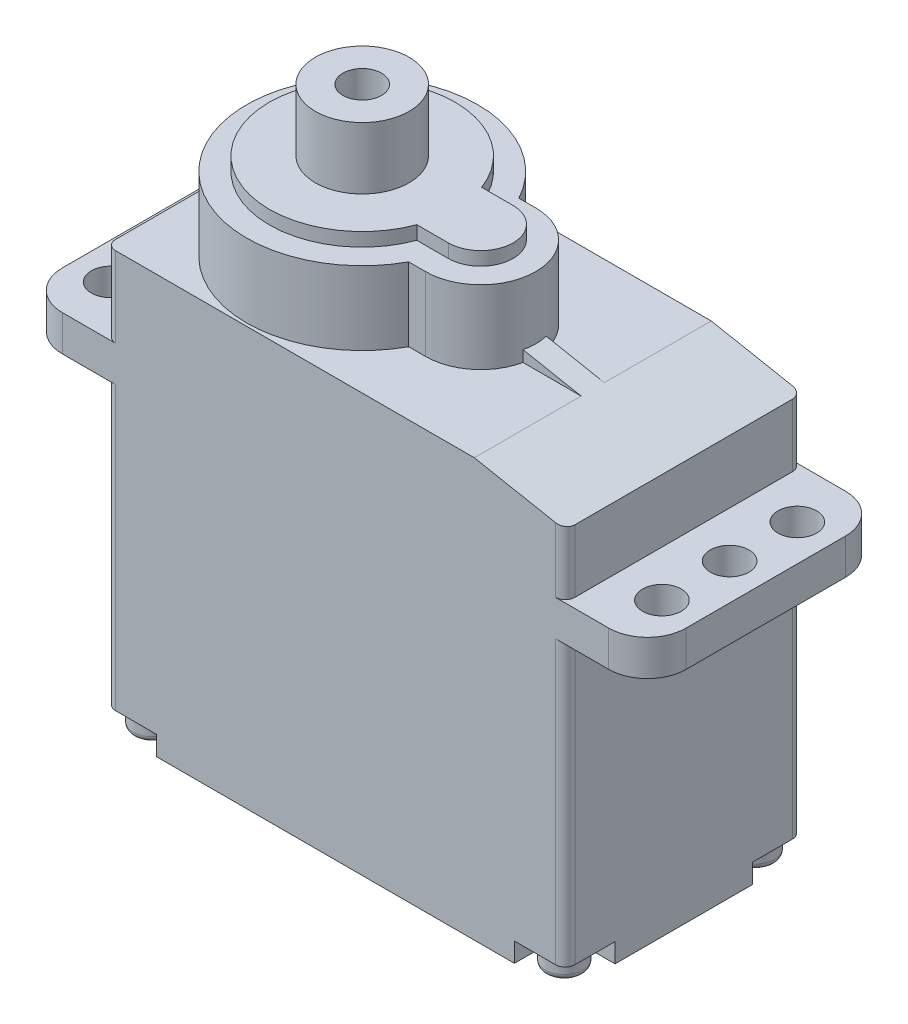
from build123d import *

# Parameters (mm, degrees)
BOSS_EXTRUDE1_DEPTH = 6.125
BOSS_EXTRUDE2_DEPTH = 3.8
BOSS_EXTRUDE3_DEPTH = 0.7
SKETCH4_R           = 1
CUT_EXTRUDE1_DEPTH  = 27.766257209
SKETCH5_R           = 0.975
CUT_EXTRUDE2_DEPTH  = 1
BOSS_EXTRUDE6_DEPTH = 0.6
SKETCH9_W           = 1.425
SKETCH9_H           = 3.2
FILLET1_R           = 0.3
FILLET2_R           = 2
FILLET3_R           = 0.5


with BuildPart() as part:
    # Sketch1 → Boss-Extrude1 (new, symmetric)
    with BuildSketch(Plane.XY):
        Polygon((-7.13, 6), (11.92, 6), (16.62, 5.1), (16.62, 1.85), (20.87, 1.85), (20.87, 0), (16.62, 0), (16.62, -15.6), (-7.13, -15.6), (-7.13, 0), (-11.38, 0), (-11.38, 1.85), (-7.13, 1.85), align=None)
    extrude(amount=BOSS_EXTRUDE1_DEPTH, both=True)

    # Sketch2 → Boss-Extrude2 (add)
    with BuildSketch(Plane(origin=(0, 6, 0), x_dir=(1, 0, 0), z_dir=(0, 1, 0))):
        with BuildLine():
            Line((5.251487884, -2.85), (6.125, -2.85))
            ThreePointArc((6.125, -2.85), (8.975, 0), (6.125, 2.85))
            Line((6.125, 2.85), (5.251487884, 2.85))
            ThreePointArc((5.251487884, 2.85), (-5.975, 0), (5.251487884, -2.85))
        make_face()
    extrude(amount=BOSS_EXTRUDE2_DEPTH)

    # Sketch3 → Boss-Extrude3 (add)
    with BuildSketch(Plane(origin=(0, 9.8, 0), x_dir=(1, 0, 0), z_dir=(0, 1, 0))):
        with BuildLine():
            Line((4.498263554, -1.675), (6.125, -1.675))
            ThreePointArc((6.125, -1.675), (7.8, 0), (6.125, 1.675))
            Line((6.125, 1.675), (4.498263554, 1.675))
            ThreePointArc((4.498263554, 1.675), (-4.8, 0), (4.498263554, -1.675))
        make_face()
    extrude(amount=BOSS_EXTRUDE3_DEPTH)

    # Sketch4 → Cut-Extrude1 (cut, through all)
    with BuildSketch(Plane(origin=(0, 0, 0), x_dir=(1, 0, 0), z_dir=(0, 1, 0))):
        with Locations((-9.505, 3.5)):
            Circle(SKETCH4_R)
        with Locations((-9.505, -3.5)):
            Circle(SKETCH4_R)
        with Locations((18.995, 3.5)):
            Circle(SKETCH4_R)
        with Locations((18.995, -3.5)):
            Circle(SKETCH4_R)
        with Locations((18.995, 0)):
            Circle(SKETCH4_R)
        with Locations((-9.505, 0)):
            Circle(SKETCH4_R)
    extrude(amount=CUT_EXTRUDE1_DEPTH, mode=Mode.SUBTRACT)

    # Sketch5 → Cut-Extrude2 (cut)
    # profile 1 of 4: a face of its own
    with BuildSketch(Plane.XZ.offset(15.6)):
        with BuildLine():
            Line((16.62, 6.125), (13.995, 6.125))
            Line((13.995, 6.125), (13.995, 4.85))
            ThreePointArc((13.995, 4.85), (14.375761184, 3.930761184), (15.295, 3.55))
            Line((15.295, 3.55), (16.62, 3.55))
            Line((16.62, 3.55), (16.62, 6.125))
        make_face()
        with Locations((15.395, 4.95)):
            Circle(SKETCH5_R, mode=Mode.SUBTRACT)
    # profile 2 of 4: a face of its own
    with BuildSketch(Plane.XZ.offset(15.6)):
        with BuildLine():
            Line((16.62, -6.125), (13.995, -6.125))
            Line((13.995, -6.125), (13.995, -4.85))
            ThreePointArc((13.995, -4.85), (14.375761184, -3.930761184), (15.295, -3.55))
            Line((15.295, -3.55), (16.62, -3.55))
            Line((16.62, -3.55), (16.62, -6.125))
        make_face()
        with Locations((15.395, -4.95)):
            Circle(SKETCH5_R, mode=Mode.SUBTRACT)
    # profile 3 of 4: a face of its own
    with BuildSketch(Plane.XZ.offset(15.6)):
        with BuildLine():
            Line((-7.13, 6.125), (-4.505, 6.125))
            Line((-4.505, 6.125), (-4.505, 4.85))
            ThreePointArc((-4.505, 4.85), (-4.885761184, 3.930761184), (-5.805, 3.55))
            Line((-5.805, 3.55), (-7.13, 3.55))
            Line((-7.13, 3.55), (-7.13, 6.125))
        make_face()
        with Locations((-5.905, 4.95)):
            Circle(SKETCH5_R, mode=Mode.SUBTRACT)
    # profile 4 of 4: a face of its own
    with BuildSketch(Plane.XZ.offset(15.6)):
        with BuildLine():
            Line((-7.13, -6.125), (-4.505, -6.125))
            Line((-4.505, -6.125), (-4.505, -4.85))
            ThreePointArc((-4.505, -4.85), (-4.885761184, -3.930761184), (-5.805, -3.55))
            Line((-5.805, -3.55), (-7.13, -3.55))
            Line((-7.13, -3.55), (-7.13, -6.125))
        make_face()
        with Locations((-5.905, -4.95)):
            Circle(SKETCH5_R, mode=Mode.SUBTRACT)
    extrude(amount=-CUT_EXTRUDE2_DEPTH, mode=Mode.SUBTRACT)

    # Sketch8 → Boss-Extrude6 (add, symmetric)
    with BuildSketch(Plane.XY):
        Polygon((11.92, 6), (7.8, 6.78893617), (7.8, 6), align=None)
    extrude(amount=BOSS_EXTRUDE6_DEPTH, both=True)

    # Sketch9 → Revolve1 (revolve)
    with BuildSketch(Plane.XY):
        with Locations((1.7125, 12.1)):
            Rectangle(SKETCH9_W, SKETCH9_H)
    revolve(axis=Axis((0, 55, 0), (0, -1, 0)))

    # Fillet1
    fillet1_edges = [part.edges().sort_by_distance(p)[0] for p in [
        (14.42, -15.6, -4.95),
        (14.42, -15.6, 4.95),
        (-6.88, -15.6, -4.95),
        (-6.88, -15.6, 4.95),
    ]]
    fillet(fillet1_edges, radius=FILLET1_R)

    # Fillet2
    fillet2_edges = [part.edges().sort_by_distance(p)[0] for p in [
        (20.87, 0.925, -6.125),
        (20.87, 0.925, 6.125),
        (-11.38, 0.925, 6.125),
        (-11.38, 0.925, -6.125),
    ]]
    fillet(fillet2_edges, radius=FILLET2_R)

    # Fillet3
    fillet3_edges = [part.edges().sort_by_distance(p)[0] for p in [
        (16.62, -7.3, -6.125),
        (16.62, 3.475, -6.125),
        (16.62, 3.475, 6.125),
        (16.62, -7.3, 6.125),
        (-7.13, -7.3, -6.125),
        (-7.13, 3.925, -6.125),
        (-7.13, 3.925, 6.125),
        (-7.13, -7.3, 6.125),
    ]]
    fillet(fillet3_edges, radius=FILLET3_R)


solid = part.part
